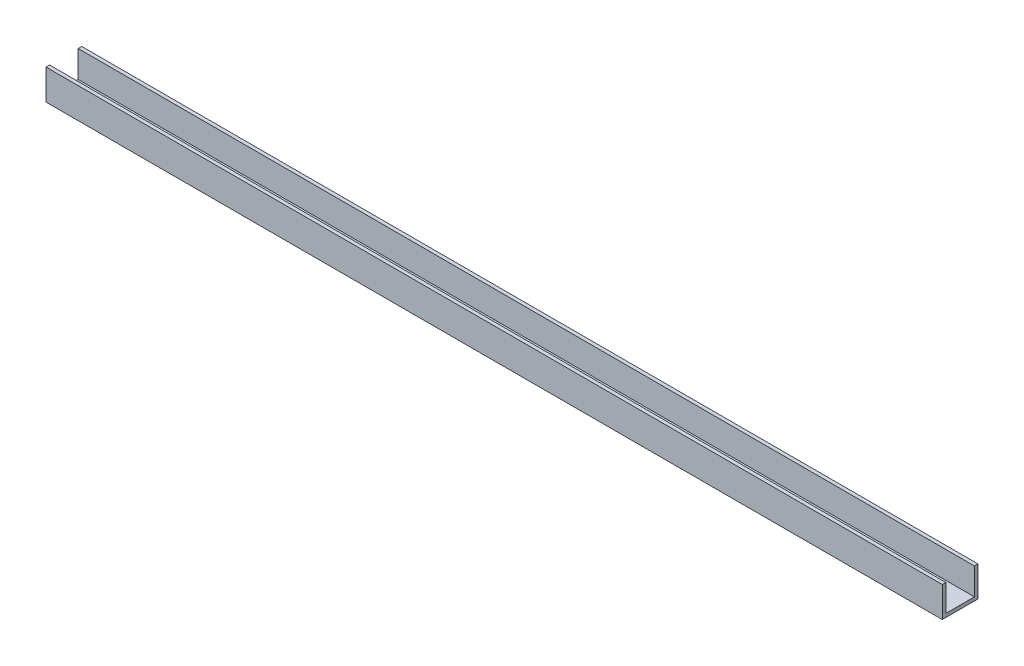
from build123d import *

# Parameters (mm, degrees)
BOSS_EXTRUDE1_DEPTH = 251
CUT_EXTRUDE1_REACH  = 253.194
SKETCH3_R           = 2.5


with BuildPart() as part:
    # Sketch2 → Boss-Extrude1 (new body)
    with BuildSketch(Plane(origin=(0, 0, 0), x_dir=(0, 0, -1), z_dir=(1, 0, 0))):
        Polygon((-4, 4.25), (-4, -3.25), (4, -3.25), (4, 4.25), (5, 4.25), (5, -4.25), (-5, -4.25), (-5, 4.25), align=None)
    extrude(amount=BOSS_EXTRUDE1_DEPTH)

    # Sketch3 → Cut-Extrude1 (cut, up to next)
    with BuildSketch(Plane.XZ.offset(4.25), mode=Mode.PRIVATE) as cut_extrude1_sk1:
        with Locations(Location((19, 0, 0), (0, 0, 270))):
            Circle(SKETCH3_R)
    cut_extrude1_tool1 = extrude(cut_extrude1_sk1.sketch, amount=-CUT_EXTRUDE1_REACH, mode=Mode.PRIVATE) & part.part
    # Sketch3 → Cut-Extrude1 (cut, up to next)
    with BuildSketch(Plane.XZ.offset(4.25), mode=Mode.PRIVATE) as cut_extrude1_sk2:
        with Locations(Location((27.5, 0, 0), (0, 0, 270))):
            Circle(SKETCH3_R)
    cut_extrude1_tool2 = extrude(cut_extrude1_sk2.sketch, amount=-CUT_EXTRUDE1_REACH, mode=Mode.PRIVATE) & part.part
    # Sketch3 → Cut-Extrude1 (cut, up to next)
    with BuildSketch(Plane.XZ.offset(4.25), mode=Mode.PRIVATE) as cut_extrude1_sk3:
        with Locations(Location((36, 0, 0), (0, 0, 270))):
            Circle(SKETCH3_R)
    cut_extrude1_tool3 = extrude(cut_extrude1_sk3.sketch, amount=-CUT_EXTRUDE1_REACH, mode=Mode.PRIVATE) & part.part
    # Sketch3 → Cut-Extrude1 (cut, up to next)
    with BuildSketch(Plane.XZ.offset(4.25), mode=Mode.PRIVATE) as cut_extrude1_sk4:
        with Locations(Location((115, 0, 0), (0, 0, 270))):
            Circle(SKETCH3_R)
    cut_extrude1_tool4 = extrude(cut_extrude1_sk4.sketch, amount=-CUT_EXTRUDE1_REACH, mode=Mode.PRIVATE) & part.part
    # Sketch3 → Cut-Extrude1 (cut, up to next)
    with BuildSketch(Plane.XZ.offset(4.25), mode=Mode.PRIVATE) as cut_extrude1_sk5:
        with Locations(Location((123.5, 0, 0), (0, 0, 270))):
            Circle(SKETCH3_R)
    cut_extrude1_tool5 = extrude(cut_extrude1_sk5.sketch, amount=-CUT_EXTRUDE1_REACH, mode=Mode.PRIVATE) & part.part
    # Sketch3 → Cut-Extrude1 (cut, up to next)
    with BuildSketch(Plane.XZ.offset(4.25), mode=Mode.PRIVATE) as cut_extrude1_sk6:
        with Locations(Location((132, 0, 0), (0, 0, 270))):
            Circle(SKETCH3_R)
    cut_extrude1_tool6 = extrude(cut_extrude1_sk6.sketch, amount=-CUT_EXTRUDE1_REACH, mode=Mode.PRIVATE) & part.part
    # Sketch3 → Cut-Extrude1 (cut, up to next)
    with BuildSketch(Plane.XZ.offset(4.25), mode=Mode.PRIVATE) as cut_extrude1_sk7:
        with Locations(Location((232, 0, 0), (0, 0, 270))):
            Circle(SKETCH3_R)
    cut_extrude1_tool7 = extrude(cut_extrude1_sk7.sketch, amount=-CUT_EXTRUDE1_REACH, mode=Mode.PRIVATE) & part.part
    # Sketch3 → Cut-Extrude1 (cut, up to next)
    with BuildSketch(Plane.XZ.offset(4.25), mode=Mode.PRIVATE) as cut_extrude1_sk8:
        with Locations(Location((223.5, 0, 0), (0, 0, 270))):
            Circle(SKETCH3_R)
    cut_extrude1_tool8 = extrude(cut_extrude1_sk8.sketch, amount=-CUT_EXTRUDE1_REACH, mode=Mode.PRIVATE) & part.part
    # Sketch3 → Cut-Extrude1 (cut, up to next)
    with BuildSketch(Plane.XZ.offset(4.25), mode=Mode.PRIVATE) as cut_extrude1_sk9:
        with Locations(Location((215, 0, 0), (0, 0, 270))):
            Circle(SKETCH3_R)
    cut_extrude1_tool9 = extrude(cut_extrude1_sk9.sketch, amount=-CUT_EXTRUDE1_REACH, mode=Mode.PRIVATE) & part.part
    add(cut_extrude1_tool1.solids().sort_by_distance((19, -4.25, 0))[0], mode=Mode.SUBTRACT)
    add(cut_extrude1_tool2.solids().sort_by_distance((27.5, -4.25, 0))[0], mode=Mode.SUBTRACT)
    add(cut_extrude1_tool3.solids().sort_by_distance((36, -4.25, 0))[0], mode=Mode.SUBTRACT)
    add(cut_extrude1_tool4.solids().sort_by_distance((115, -4.25, 0))[0], mode=Mode.SUBTRACT)
    add(cut_extrude1_tool5.solids().sort_by_distance((123.5, -4.25, 0))[0], mode=Mode.SUBTRACT)
    add(cut_extrude1_tool6.solids().sort_by_distance((132, -4.25, 0))[0], mode=Mode.SUBTRACT)
    add(cut_extrude1_tool7.solids().sort_by_distance((232, -4.25, 0))[0], mode=Mode.SUBTRACT)
    add(cut_extrude1_tool8.solids().sort_by_distance((223.5, -4.25, 0))[0], mode=Mode.SUBTRACT)
    add(cut_extrude1_tool9.solids().sort_by_distance((215, -4.25, 0))[0], mode=Mode.SUBTRACT)


solid = part.part
